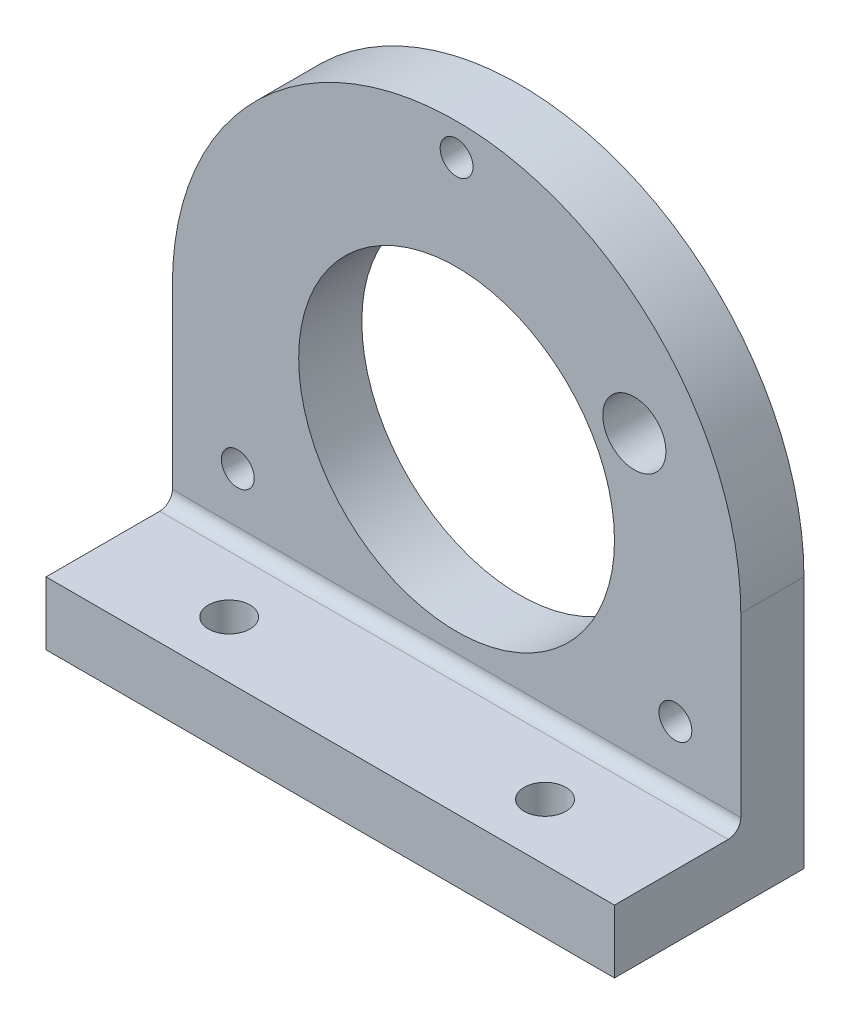
from build123d import *

# Parameters (mm, degrees)
SKETCH_1_R          = 22.5
SKETCH_1_R_2        = 12.5
SKETCH_1_R_3        = 1.3
EXTRUDE_1_DEPTH     = 4
EXTRUDE_START       = -4
EXTRUDE_2_DEPTH     = 4
SKETCH_3_W          = 45
SKETCH_3_H          = 5
EXTRUDE_3_DEPTH     = 8
CUT_EXTRUDE_START   = -10
CUT_EXTRUDE_2_DEPTH = 10
SKETCH_6_R          = 1.3
SKETCH_6_R_2        = 12.5
EXTRUDE_4_DEPTH     = 8
CUT_EXTRUDE_3_DEPTH = 4
SKETCH_8_R          = 2.5
CUT_EXTRUDE_4_DEPTH = 10
SKETCH_9_W          = 45
SKETCH_9_H          = 5
EXTRUDE_5_DEPTH     = 10
FILLET_1_R          = 1
CUT_EXTRUDE_5_DEPTH = 3
SKETCH_11_R         = 1.65
CUT_EXTRUDE_6_DEPTH = 13


with BuildPart() as part:
    # 草图1 → 凸台-拉伸1 (new body)
    with BuildSketch(Plane.XY):
        Circle(SKETCH_1_R)
        Circle(SKETCH_1_R_2, mode=Mode.SUBTRACT)
        with Locations((0, 20)):
            Circle(SKETCH_1_R_3, mode=Mode.SUBTRACT)
        with Locations((-17.320508076, -10)):
            Circle(SKETCH_1_R_3, mode=Mode.SUBTRACT)
        with Locations((17.320508076, -10)):
            Circle(SKETCH_1_R_3, mode=Mode.SUBTRACT)
    extrude(amount=EXTRUDE_1_DEPTH)

    # 草图2 → 凸台-拉伸2 (add)
    with BuildSketch(Plane.XY.offset(4).offset(EXTRUDE_START)):
        with BuildLine():
            Line((-22.5, 0), (-22.5, -20))
            Line((-22.5, -20), (-10.307764064, -20))
            ThreePointArc((-10.307764064, -20), (-19.211646096, -11.711646096), (-22.5, 0))
        make_face()
        with BuildLine():
            Line((22.5, -20), (22.5, 0))
            ThreePointArc((22.5, 0), (19.211646096, -11.711646096), (10.307764064, -20))
            Line((10.307764064, -20), (22.5, -20))
        make_face()
    extrude(amount=EXTRUDE_2_DEPTH)

    # 草图3 → 凸台-拉伸3 (add)
    with BuildSketch(Plane.XY.offset(4)):
        with Locations((0, -17.5)):
            Rectangle(SKETCH_3_W, SKETCH_3_H)
    extrude(amount=EXTRUDE_3_DEPTH)

    # 草图5 → 切除-拉伸2 (cut)
    with BuildSketch(Plane.XY.offset(4).offset(CUT_EXTRUDE_START)):
        with BuildLine():
            Line((10.307764064, -20), (-10.307764064, -20))
            ThreePointArc((-10.307764064, -20), (0, -22.5), (10.307764064, -20))
        make_face()
    extrude(amount=CUT_EXTRUDE_2_DEPTH, mode=Mode.SUBTRACT)

    # 草图6 → 凸台-拉伸4 (add)
    with BuildSketch(Plane.XY.offset(4)):
        with BuildLine():
            Line((-22.5, -15), (22.5, -15))
            Line((22.5, -15), (22.5, 0))
            ThreePointArc((22.5, 0), (0, 22.5), (-22.5, 0))
            Line((-22.5, 0), (-22.5, -15))
        make_face()
        with Locations(Location((17.320508076, -10, 0), (0, 0, 180))):
            Circle(SKETCH_6_R, mode=Mode.SUBTRACT)
        with Locations(Location((-17.320508076, -10, 0), (0, 0, 180))):
            Circle(SKETCH_6_R, mode=Mode.SUBTRACT)
        with Locations(Location((0, 20, 0), (0, 0, 180))):
            Circle(SKETCH_6_R, mode=Mode.SUBTRACT)
        with Locations(Location((0, 0, 0), (0, 0, 180))):
            Circle(SKETCH_6_R_2, mode=Mode.SUBTRACT)
    extrude(amount=EXTRUDE_4_DEPTH)

    # 草图7 → 切除-拉伸3 (cut)
    with BuildSketch(Plane(origin=(0, 0, 0), x_dir=(-1, 0, 0), z_dir=(0, 0, -1))):
        with BuildLine():
            Line((-22.5, 0), (-22.5, -20))
            Line((-22.5, -20), (22.5, -20))
            Line((22.5, -20), (22.5, 0))
            ThreePointArc((22.5, 0), (0, 22.5), (-22.5, 0))
        make_face()
    extrude(amount=-CUT_EXTRUDE_3_DEPTH, mode=Mode.SUBTRACT)

    # 草图8 → 切除-拉伸4 (cut)
    with BuildSketch(Plane.XY.offset(12)):
        with Locations((14.071515431, 8.124193222)):
            Circle(SKETCH_8_R)
    extrude(amount=-CUT_EXTRUDE_4_DEPTH, mode=Mode.SUBTRACT)

    # 草图9 → 凸台-拉伸5 (add)
    with BuildSketch(Plane.XY.offset(12)):
        with Locations((0, -17.5)):
            Rectangle(SKETCH_9_W, SKETCH_9_H)
    extrude(amount=EXTRUDE_5_DEPTH)

    # 圆角1
    fillet_1_edges = [part.edges().sort_by_distance(p)[0] for p in [
        (0, -15, 12),
    ]]
    fillet(fillet_1_edges, radius=FILLET_1_R)

    # 草图10 → 切除-拉伸5 (cut)
    with BuildSketch(Plane(origin=(0, 0, 4), x_dir=(-1, 0, 0), z_dir=(0, 0, -1))):
        with BuildLine():
            Line((-22.5, 0), (-22.5, -20))
            Line((-22.5, -20), (22.5, -20))
            Line((22.5, -20), (22.5, 0))
            ThreePointArc((22.5, 0), (0, 22.5), (-22.5, 0))
        make_face()
    extrude(amount=-CUT_EXTRUDE_5_DEPTH, mode=Mode.SUBTRACT)

    # 草图11 → 切除-拉伸6 (cut)
    with BuildSketch(Plane(origin=(0, -15, 0), x_dir=(1, 0, 0), z_dir=(0, 1, 0))):
        with Locations(Location((-12.5, -17.5, 0), (0, 0, 270))):
            Circle(SKETCH_11_R)
        with Locations(Location((12.5, -17.5, 0), (0, 0, 270))):
            Circle(SKETCH_11_R)
    extrude(amount=-CUT_EXTRUDE_6_DEPTH, mode=Mode.SUBTRACT)


solid = part.part
